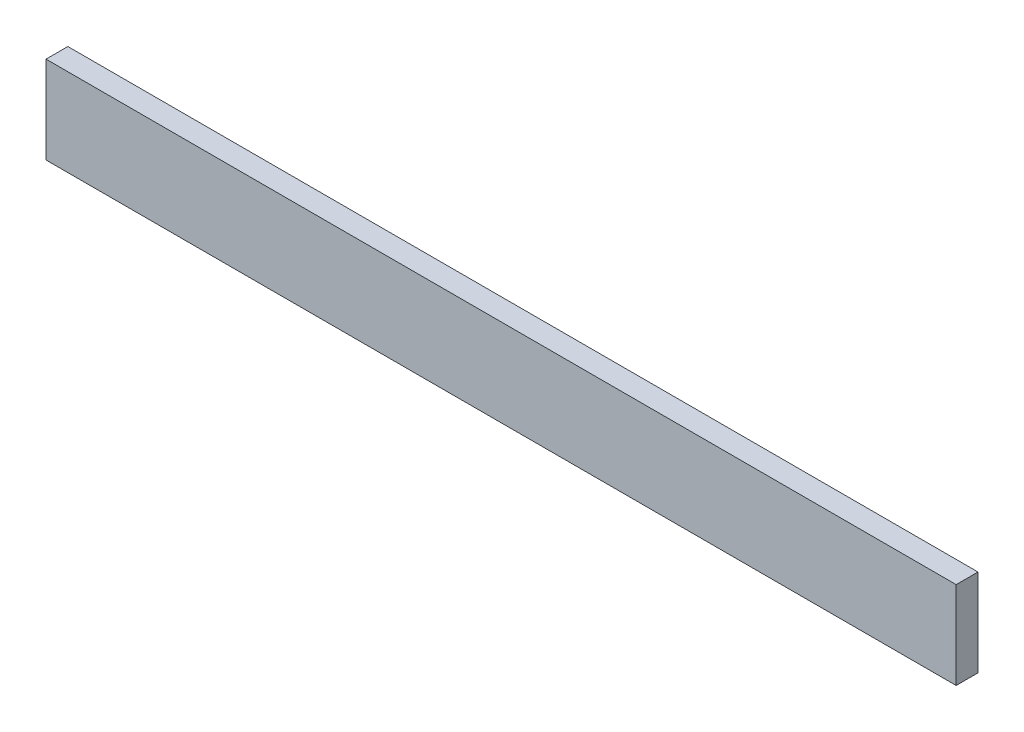
from build123d import *

# Parameters (mm, degrees)
BOSS_EXTRUDE1_DEPTH = 3


with BuildPart() as part:
    # Sketch1 → Boss-Extrude1 (new body)
    with BuildSketch(Plane.XY):
        Polygon((-83.777379734, 0), (-95.777379734, 0), (-95.777379734, -12), (29.222620266, -12), (29.222620266, 0), (17.222620266, 0), align=None)
    extrude(amount=BOSS_EXTRUDE1_DEPTH)


solid = part.part
